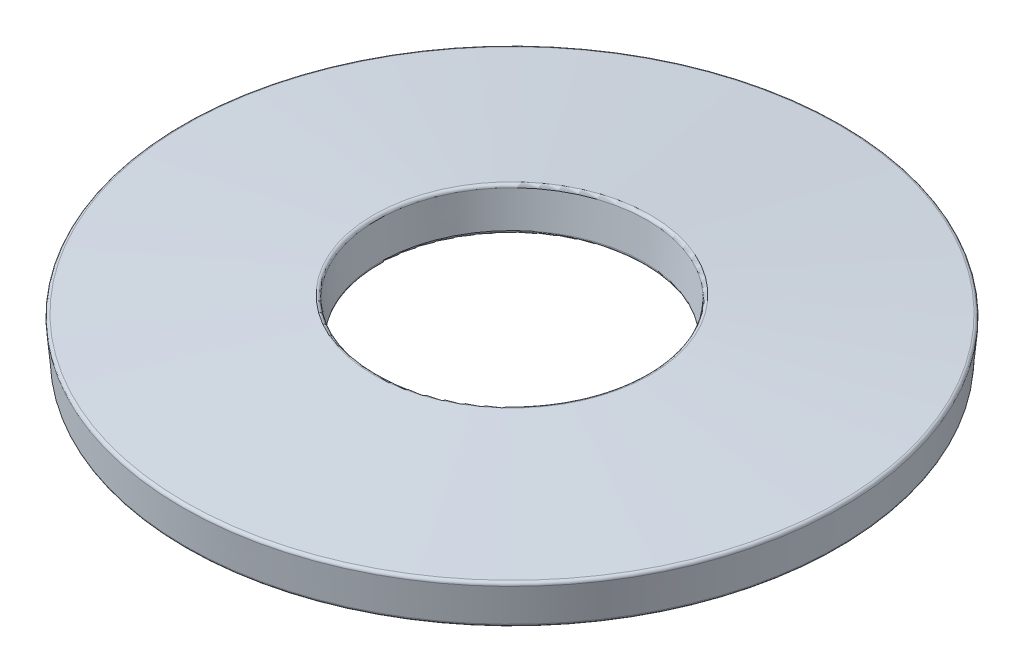
from build123d import *

# Parameters (mm, degrees)
FILLET1_R = 0.0375


with BuildPart() as part:
    # Sketch2 → Revolve1 (revolve)
    with BuildSketch(Plane.XY, mode=Mode.PRIVATE) as revolve1_sk:
        Polygon((1.6, -0.148177567), (1.64265105, 0.35), (4, 0.148177567), (3.95734895, -0.35), align=None)
    revolve(revolve1_sk.sketch.rotate(Axis((0, 0.35, 0), (0, -1, 0)), 90), axis=Axis((0, 0.35, 0), (0, -1, 0)))

    # Fillet1
    fillet1_edges = [part.edges().sort_by_distance(p)[0] for p in [
        (0, -0.35, -3.95734895),
        (0, 0.148177567, -4),
        (0, 0.35, -1.64265105),
        (0, -0.148177567, -1.6),
    ]]
    fillet(fillet1_edges, radius=FILLET1_R)


solid = part.part
